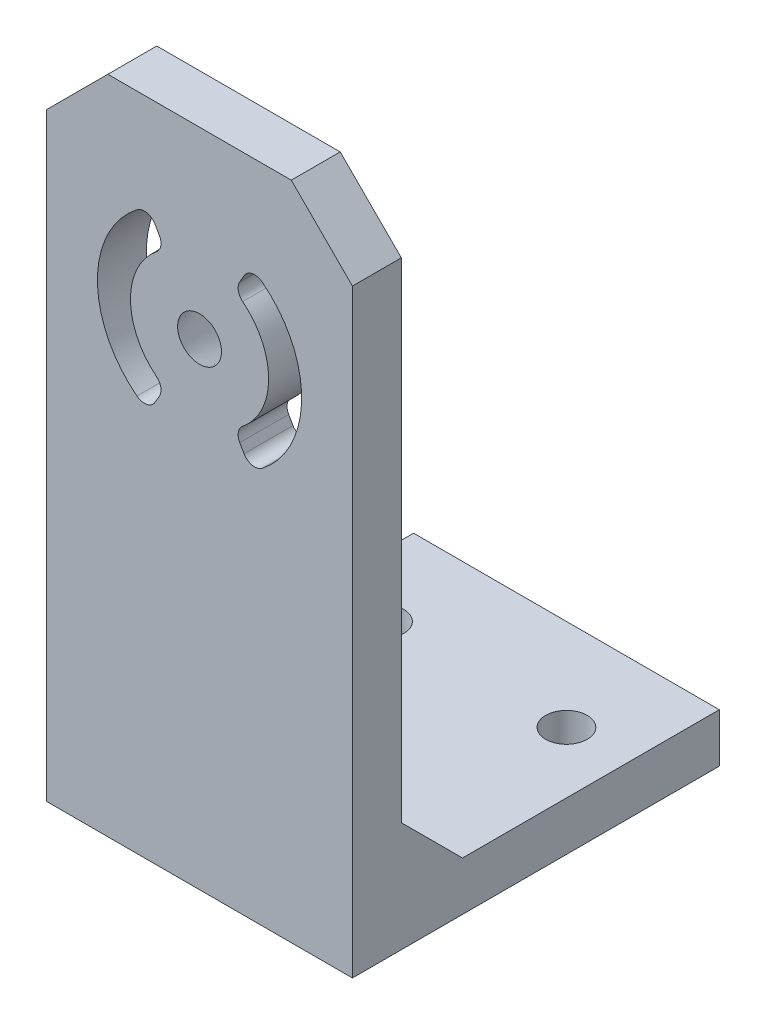
from build123d import *

# Parameters (mm, degrees)
SKETCH_2_W          = 25
SKETCH_2_H          = 30
SKETCH_2_R          = 1.7
EXTRUDE_1_DEPTH     = 4
SKETCH_3_W          = 25
SKETCH_3_H          = 4
EXTRUDE_2_DEPTH     = 50
SKETCH_7_R          = 3.25
CUT_EXTRUDE_3_DEPTH = 4
CUT_EXTRUDE_3_DRAFT = -20
CUT_EXTRUDE_4_DEPTH = 65.93843238
EXTRUDE_3_DEPTH     = 25
CHAMFER_1_SIZE      = 5
FILLET_1_R          = 1


with BuildPart() as part:
    # 草图2 → 凸台-拉伸1 (new body)
    with BuildSketch(Plane(origin=(0, 0, 0), x_dir=(1, 0, 0), z_dir=(0, 1, 0))):
        with Locations((12.5, 15)):
            Rectangle(SKETCH_2_W, SKETCH_2_H)
        with Locations(Location((5, 22.5, 0), (0, 0, 270))):
            Circle(SKETCH_2_R, mode=Mode.SUBTRACT)
        with Locations(Location((20, 22.5, 0), (0, 0, 270))):
            Circle(SKETCH_2_R, mode=Mode.SUBTRACT)
    extrude(amount=EXTRUDE_1_DEPTH)

    # 草图3 → 凸台-拉伸2 (add)
    with BuildSketch(Plane(origin=(0, 4, 0), x_dir=(1, 0, 0), z_dir=(0, 1, 0))):
        with Locations((12.5, 2)):
            Rectangle(SKETCH_3_W, SKETCH_3_H)
    extrude(amount=EXTRUDE_2_DEPTH)


with BuildPart() as cut_extrude_3_tool:
    # 草图7 → 切除-拉伸3 (with draft: the straight prism first)
    with BuildSketch(Plane(origin=(0, 0, -4), x_dir=(-1, 0, 0), z_dir=(0, 0, -1))):
        with Locations((-12.5, 39)):
            Circle(SKETCH_7_R)
    extrude(amount=-CUT_EXTRUDE_3_DEPTH)
    # 切除-拉伸3: the draft: its side faces are tilted about the plane it starts from
    cut_extrude_3_sides = [cut_extrude_3_tool.faces().sort_by_distance(p)[0] for p in [
        (15.75, 39, -2),
    ]]
    draft(cut_extrude_3_sides, Plane(origin=(0, 0, -4), x_dir=(-1, 0, 0), z_dir=(0, 0, -1)), CUT_EXTRUDE_3_DRAFT)


with BuildPart() as part_1:
    add(part.part)

    # 切除-拉伸3: cut by cut_extrude_3_tool
    add(cut_extrude_3_tool.part, mode=Mode.SUBTRACT)

    # 草图6 → 切除-拉伸4 (cut, through all)
    with BuildSketch(Plane(origin=(0, 0, -4), x_dir=(-1, 0, 0), z_dir=(0, 0, -1))):
        with BuildLine():
            Line((-16.675, 46.231312122), (-15.325, 43.893043531))
            ThreePointArc((-15.325, 43.893043531), (-18.15, 39), (-15.325, 34.106956469))
            Line((-15.325, 34.106956469), (-16.675, 31.768687878))
            ThreePointArc((-16.675, 31.768687878), (-20.85, 39), (-16.675, 46.231312122))
        make_face()
        with BuildLine():
            Line((-9.675, 43.893043531), (-8.325, 46.231312122))
            ThreePointArc((-8.325, 46.231312122), (-4.15, 39), (-8.325, 31.768687878))
            Line((-8.325, 31.768687878), (-9.675, 34.106956469))
            ThreePointArc((-9.675, 34.106956469), (-6.85, 39), (-9.675, 43.893043531))
        make_face()
    extrude(amount=-CUT_EXTRUDE_4_DEPTH, mode=Mode.SUBTRACT)

    # 草图9 → 凸台-拉伸3 (add)
    with BuildSketch(Plane.ZY):
        Polygon((-9, 4), (-4, 4), (-4, 9), align=None)
    extrude(amount=-EXTRUDE_3_DEPTH)

    # 倒角1
    chamfer_1_edges = [part_1.edges().sort_by_distance(p)[0] for p in [
        (0, 54, -2),
        (25, 54, -2),
    ]]
    chamfer(chamfer_1_edges, length=CHAMFER_1_SIZE)

    # 圆角1
    fillet_1_edges = [part_1.edges().sort_by_distance(p)[0] for p in [
        (9.675, 34.106956469, -2),
        (9.675, 43.893043531, -2),
        (8.325, 46.231312122, -2),
        (8.325, 31.768687878, -2),
        (16.675, 31.768687878, -2),
        (16.675, 46.231312122, -2),
        (15.325, 43.893043531, -2),
        (15.325, 34.106956469, -2),
    ]]
    fillet(fillet_1_edges, radius=FILLET_1_R)


solid = part_1.part
